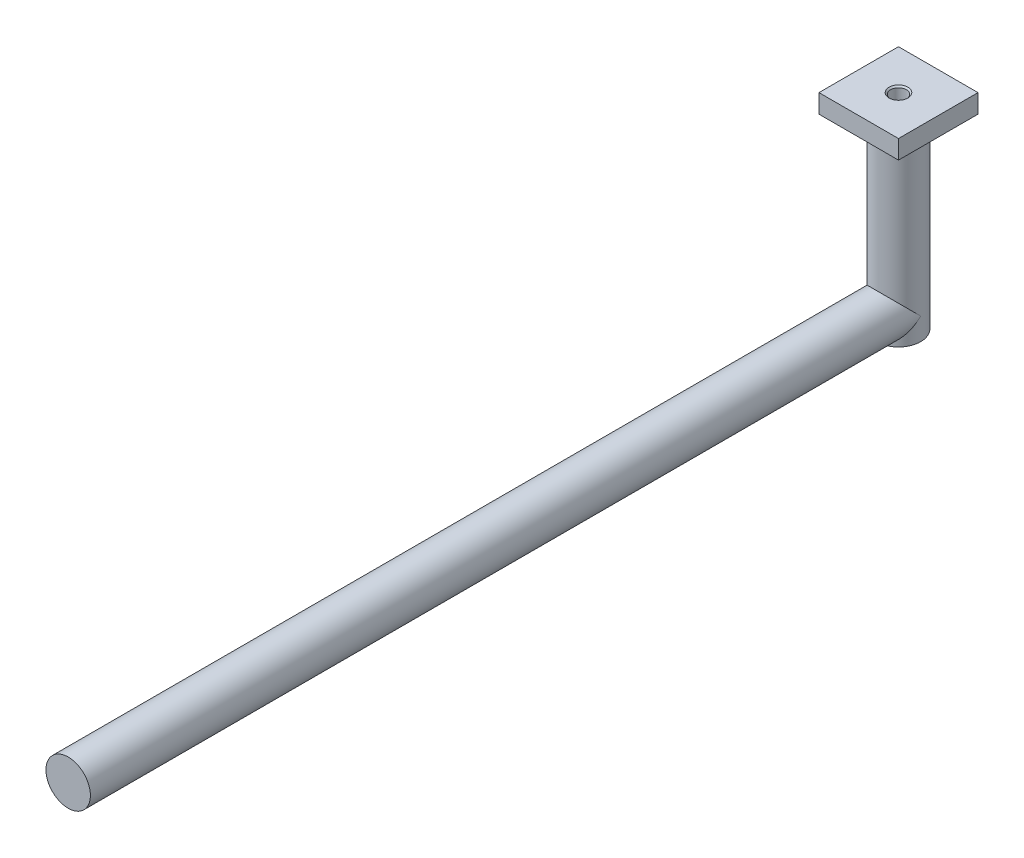
from build123d import *
from build123d.topology import SkipClean

# Parameters (mm, degrees)
SKETCH2_R                        = 9.5
BOSS_EXTRUDE1_DEPTH              = 355
SKETCH3_R                        = 9.5
BOSS_EXTRUDE2_DEPTH              = 70
BOSS_EXTRUDE3_START              = -9.5
SKETCH3_2_R                      = 9.5
BOSS_EXTRUDE3_DEPTH              = 9.5
SKETCH5_W                        = 34
SKETCH5_H                        = 34
BOSS_EXTRUDE4_DEPTH              = 8
M8X1_25_TAPPED_HOLE1_D           = 6.8
M8X1_25_TAPPED_HOLE1_CSINK_D     = 8.05
M8X1_25_TAPPED_HOLE1_CSINK_ANGLE = 90


with BuildPart() as part:
    # Sketch2 → Boss-Extrude1 (new body)
    with BuildSketch(Plane.XY):
        Circle(SKETCH2_R)
    extrude(amount=BOSS_EXTRUDE1_DEPTH)

    # Sketch3 → Boss-Extrude2 (add)
    with BuildSketch(Plane(origin=(0, 0, 0), x_dir=(1, 0, 0), z_dir=(0, 1, 0))):
        Circle(SKETCH3_R)
    extrude(amount=BOSS_EXTRUDE2_DEPTH)

    # Sketch3<2> → Boss-Extrude3 (add)
    with SkipClean():  # the faces are left unmerged after this step: merging them gives an invalid solid
        with BuildSketch(Plane(origin=(0, 0, 0), x_dir=(1, 0, 0), z_dir=(0, 1, 0)).offset(BOSS_EXTRUDE3_START)):
            Circle(SKETCH3_2_R)
        extrude(amount=BOSS_EXTRUDE3_DEPTH)

    # Sketch5 → Boss-Extrude4 (add)
    with BuildSketch(Plane(origin=(0, 70, 0), x_dir=(1, 0, 0), z_dir=(0, 1, 0))):
        Rectangle(SKETCH5_W, SKETCH5_H)
    extrude(amount=BOSS_EXTRUDE4_DEPTH)

    # M8x1.25 Tapped Hole1 (through all)
    with Locations(Plane.ZX.offset(78)):
        with Locations((0, 0)):
            CounterSinkHole(M8X1_25_TAPPED_HOLE1_D / 2, M8X1_25_TAPPED_HOLE1_CSINK_D / 2, counter_sink_angle=M8X1_25_TAPPED_HOLE1_CSINK_ANGLE)


solid = part.part
